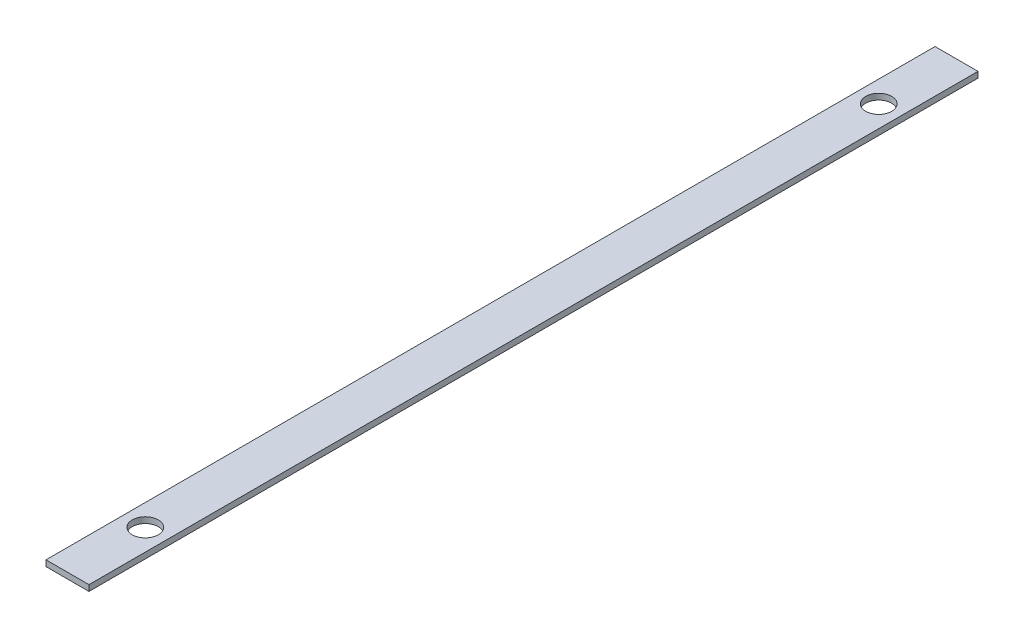
from build123d import *

# Parameters (mm, degrees)
SKETCH1_W           = 5.8
SKETCH1_H           = 0.8
BOSS_EXTRUDE1_DEPTH = 60
SKETCH3_R           = 1.75
CUT_EXTRUDE1_DEPTH  = 0.8


with BuildPart() as part:
    # Sketch1 → Boss-Extrude1 (new, symmetric)
    with BuildSketch(Plane.XY):
        Rectangle(SKETCH1_W, SKETCH1_H)
    extrude(amount=BOSS_EXTRUDE1_DEPTH, both=True)

    # Sketch3 → Cut-Extrude1 (cut)
    with BuildSketch(Plane(origin=(0, 0.4, 0), x_dir=(1, 0, 0), z_dir=(0, 1, 0))):
        with Locations(Location((0, -49.5, 0), (0, 0, 270))):
            Circle(SKETCH3_R)
        with Locations(Location((0, 49.5, 0), (0, 0, 270))):
            Circle(SKETCH3_R)
    extrude(amount=-CUT_EXTRUDE1_DEPTH, mode=Mode.SUBTRACT)


solid = part.part
